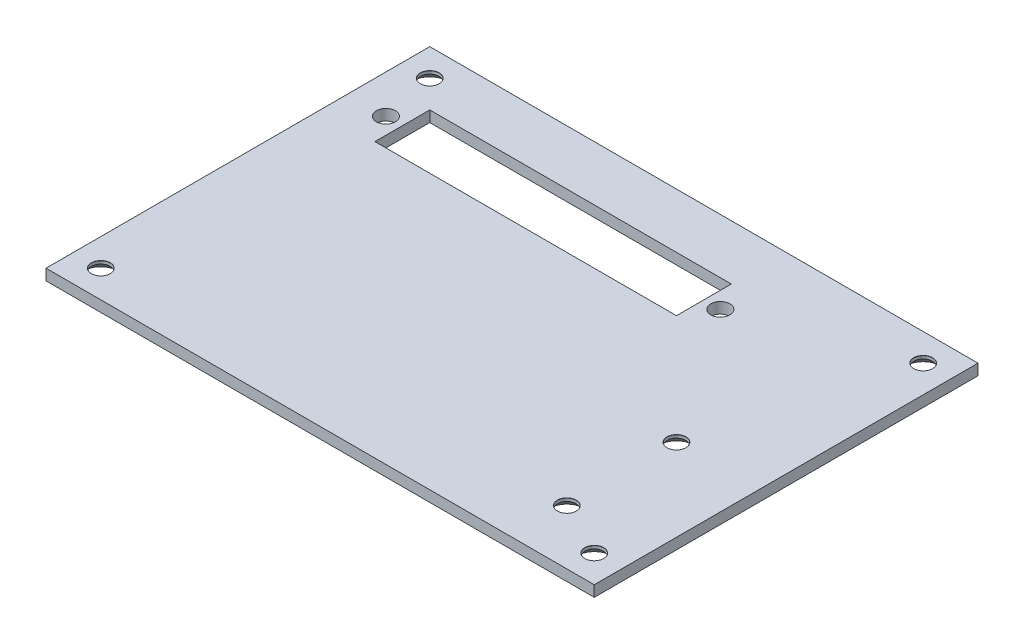
from build123d import *

# Parameters (mm, degrees)
SKIZZE1_W                                      = 100
SKIZZE1_H                                      = 70
SKIZZE1_W_2                                    = 55
SKIZZE1_H_2                                    = 10
AUFSATZ_LINEAR_AUSTRAGEN1_DEPTH                = 2
F_3_5_3_5_DURCHMESSER_BOHRUNG1_D               = 3.5
FORMSENKUNG_F_R_M3_LINSENSENKSCHRAUB_2_COUNT   = 2
FORMSENKUNG_F_R_M3_LINSENSENKSCHRAUB_2_PITCH   = 90
FORMSENKUNG_F_R_M3_LINSENSENKSCHRAUB_3_COUNT   = 2
FORMSENKUNG_F_R_M3_LINSENSENKSCHRAUB_3_PITCH   = 108.166538264
FORMSENKUNG_F_R_M3_LINSENSENKSCHRAUB_4_COUNT   = 2
FORMSENKUNG_F_R_M3_LINSENSENKSCHRAUB_4_PITCH   = 60
FORMSENKUNG_F_R_M3_LINSENSENKSCHRAUB_5_A_COUNT = 2
FORMSENKUNG_F_R_M3_LINSENSENKSCHRAUB_5_A_PITCH = 20


with BuildPart() as part:
    # Skizze1 → Aufsatz-Linear austragen1 (new body)
    with BuildSketch(Plane(origin=(0, 0, 0), x_dir=(1, 0, 0), z_dir=(0, 1, 0))):
        with Locations((50, 35)):
            Rectangle(SKIZZE1_W, SKIZZE1_H)
        with Locations((37.5, 55)):
            Rectangle(SKIZZE1_W_2, SKIZZE1_H_2, mode=Mode.SUBTRACT)
    extrude(amount=AUFSATZ_LINEAR_AUSTRAGEN1_DEPTH)

    # Ø3.5 (3.5) Durchmesser Bohrung1 (through all)
    with Locations(Plane(origin=(0, 2, 0), x_dir=(1, 0, 0), z_dir=(0, 1, 0))):
        with Locations((7, 55), (68, 55)):
            Hole(F_3_5_3_5_DURCHMESSER_BOHRUNG1_D / 2)

    # Skizze7 → Formsenkung f_r M3 Linsensenkschraube mi (revolve, cut)
    with BuildSketch(Plane(origin=(5, 0, -5), x_dir=(0, 0, -1), z_dir=(1, 0, 0))):
        Polygon((0, 0), (0, 2), (1.725, 2), (1.7, 1.975), (1.7, 1.45), (3.15, 0), align=None)
    formsenkung_f_r_m3_linsensenkschraube_mi = revolve(axis=Axis((5, -6.35, -5), (0, 1, 0)), mode=Mode.SUBTRACT)

    # Formsenkung f_r M3 Linsensenkschraub 2: Formsenkung f_r M3 Linsensenkschraube mi ×2
    with Locations(*[(i * FORMSENKUNG_F_R_M3_LINSENSENKSCHRAUB_2_PITCH, 0, 0) for i in range(1, FORMSENKUNG_F_R_M3_LINSENSENKSCHRAUB_2_COUNT)]):
        add(formsenkung_f_r_m3_linsensenkschraube_mi, mode=Mode.SUBTRACT)

    # Formsenkung f_r M3 Linsensenkschraub 3: Formsenkung f_r M3 Linsensenkschraube mi ×2
    with Locations(*[Vector(0.8320502943378437, 0, -0.5547001962252291) * (i * FORMSENKUNG_F_R_M3_LINSENSENKSCHRAUB_3_PITCH) for i in range(1, FORMSENKUNG_F_R_M3_LINSENSENKSCHRAUB_3_COUNT)]):
        add(formsenkung_f_r_m3_linsensenkschraube_mi, mode=Mode.SUBTRACT)

    # Formsenkung f_r M3 Linsensenkschraub 4: Formsenkung f_r M3 Linsensenkschraube mi ×2
    with Locations(*[(0, 0, -i * FORMSENKUNG_F_R_M3_LINSENSENKSCHRAUB_4_PITCH) for i in range(1, FORMSENKUNG_F_R_M3_LINSENSENKSCHRAUB_4_COUNT)]):
        add(formsenkung_f_r_m3_linsensenkschraube_mi, mode=Mode.SUBTRACT)

    # Skizze9 → Formsenkung f_r M3 Linsensenkschraub 5 (revolve, cut)
    with BuildSketch(Plane(origin=(85, 0, -10), x_dir=(0, 0, -1), z_dir=(1, 0, 0))):
        Polygon((0, 0), (0, 2), (1.725, 2), (1.7, 1.975), (1.7, 1.45), (3.15, 0), align=None)
    formsenkung_f_r_m3_linsensenkschraub_5 = revolve(axis=Axis((85, -6.35, -10), (0, 1, 0)), mode=Mode.SUBTRACT)

    # Formsenkung f_r M3 Linsensenkschraub 5 a: Formsenkung f_r M3 Linsensenkschraub 5 ×2
    with Locations(*[(0, 0, -i * FORMSENKUNG_F_R_M3_LINSENSENKSCHRAUB_5_A_PITCH) for i in range(1, FORMSENKUNG_F_R_M3_LINSENSENKSCHRAUB_5_A_COUNT)]):
        add(formsenkung_f_r_m3_linsensenkschraub_5, mode=Mode.SUBTRACT)


solid = part.part
